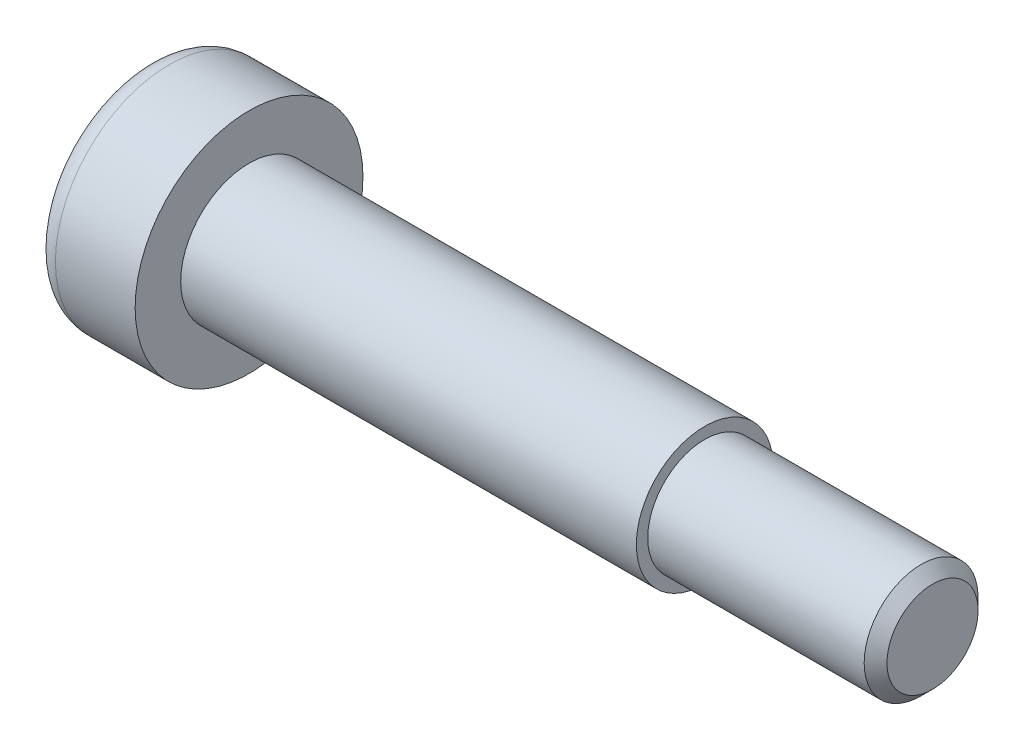
from build123d import *

# Parameters (mm, degrees)
CUT_EXTRUDE_1_DEPTH = 3
FILLET_1_R          = 1
CHAMFER_1_SIZE      = 0.5


with BuildPart() as part:
    # 草图1 → 旋转1 (revolve)
    with BuildSketch(Plane.XY, mode=Mode.PRIVATE) as revolve_1_sk:
        Polygon((0, 0), (0, 5), (4.5, 5), (4.5, 3), (24.5, 3), (24.5, 2.5), (34.5, 2.5), (34.5, 0), align=None)
    revolve(revolve_1_sk.sketch.rotate(Axis((0, 0, 0), (1, 0, 0)), 90), axis=Axis((0, 0, 0), (1, 0, 0)))

    # 草图2 → 切除-拉伸1 (cut)
    with BuildSketch(Plane.ZY):
        Polygon((0, 1.732050808), (-1.5, 0.866025404), (-1.5, -0.866025404), (0, -1.732050808), (1.5, -0.866025404), (1.5, 0.866025404), align=None)
    extrude(amount=-CUT_EXTRUDE_1_DEPTH, mode=Mode.SUBTRACT)

    # 圆角1
    fillet_1_edges = [part.edges().sort_by_distance(p)[0] for p in [
        (0, 0, -5),
    ]]
    fillet(fillet_1_edges, radius=FILLET_1_R)

    # 倒角1
    chamfer_1_edges = [part.edges().sort_by_distance(p)[0] for p in [
        (34.5, 0, -2.5),
    ]]
    chamfer(chamfer_1_edges, length=CHAMFER_1_SIZE)


solid = part.part
